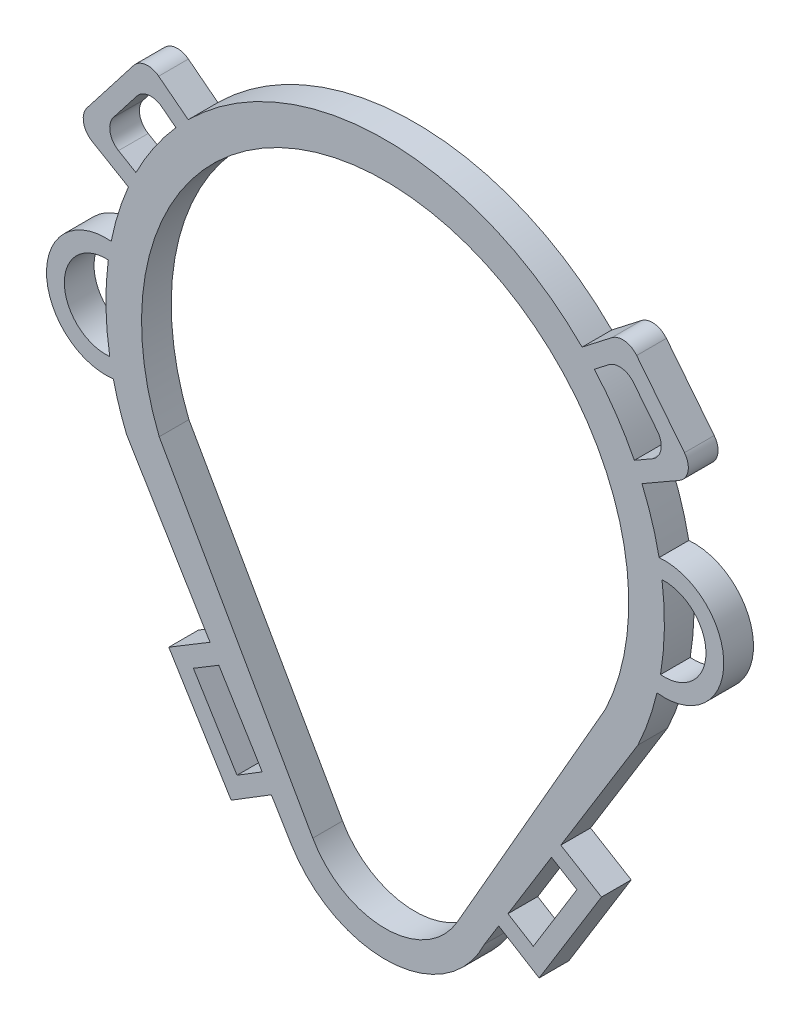
from build123d import *

# Parameters (mm, degrees)
BOSS_EXTRUDE1_DEPTH = 5
BOSS_EXTRUDE2_DEPTH = 5
BOSS_EXTRUDE3_DEPTH = 5
BOSS_EXTRUDE4_DEPTH = 5


with BuildPart() as part:
    # Sketch1 → Boss-Extrude1 (new body)
    with BuildSketch(Plane.XY):
        with BuildLine():
            Line((-43.525507403, -17.734999444), (-15.834143063, -63.566896663))
            ThreePointArc((-15.834143063, -63.566896663), (0.921831184, -72.476899782), (16.707746892, -61.94334892))
            Line((16.707746892, -61.94334892), (42.535849019, -19.992537313))
            ThreePointArc((42.535849019, -19.992537313), (1.232467134, 46.98383791), (-43.525507403, -17.734999444))
        make_face()
        with BuildLine():
            Line((-38.025051761, -15.332822263), (-12.177775824, -60.906647231))
            ThreePointArc((-12.177775824, -60.906647231), (-0.033510124, -67.999959895), (12.144573151, -60.964864893))
            Line((12.144573151, -60.964864893), (37.105740634, -17.440298507))
            ThreePointArc((37.105740634, -17.440298507), (1.149629187, 40.983879181), (-38.025051761, -15.332822263))
        make_face(mode=Mode.SUBTRACT)
    extrude(amount=BOSS_EXTRUDE1_DEPTH)

    # Sketch2 → Boss-Extrude2 (add)
    # profile 1 of 2: a face of its own
    with BuildSketch(Plane.XY.offset(5)):
        Polygon((25.915179254, -62.247528006), (36.414328126, -45.193958627), (26.996991102, -39.509073876), (16.548120684, -56.480456141), align=None)
        Polygon((27.992517968, -43.614270651), (20.675595382, -55.498645253), (24.93333337, -58.120031762), (32.273052279, -46.198264849), align=None, mode=Mode.SUBTRACT)
    # profile 2 of 2: a face of its own
    with BuildSketch(Plane.XY.offset(5)):
        Polygon((-16.548120684, -56.480456141), (-25.915179254, -62.247528006), (-36.414328126, -45.193958627), (-26.996991102, -39.509073876), align=None)
        Polygon((-32.273052279, -46.198264849), (-27.992517968, -43.614270651), (-20.675595382, -55.498645253), (-24.93333337, -58.120031762), align=None, mode=Mode.SUBTRACT)
    extrude(amount=-BOSS_EXTRUDE2_DEPTH)

    # Sketch3 → Boss-Extrude3 (add)
    # profile 1 of 2: a face of its own
    with BuildSketch(Plane.XY.offset(5)):
        with BuildLine():
            Line((-31.151373165, 31.772817784), (-38.114457897, 37.177116489))
            ThreePointArc((-38.114457897, 37.177116489), (-40.329006137, 37.783626199), (-42.323795344, 36.64657125))
            Line((-42.323795344, 36.64657125), (-50.184128352, 26.519047267))
            ThreePointArc((-50.184128352, 26.519047267), (-50.760622602, 24.115277799), (-49.336666072, 22.094683561))
            Line((-49.336666072, 22.094683561), (-41.03528616, 17.205385487))
            Line((-41.03528616, 17.205385487), (-31.151373165, 31.772817784))
        make_face()
        with BuildLine():
            Line((-35.213971315, 31.128382936), (-37.583912658, 32.967779041))
            ThreePointArc((-37.583912658, 32.967779041), (-39.798460899, 33.574288752), (-41.793250106, 32.437233803))
            Line((-41.793250106, 32.437233803), (-45.72341661, 27.373471811))
            ThreePointArc((-45.72341661, 27.373471811), (-46.29991086, 24.969702343), (-44.87595433, 22.949108105))
            Line((-44.87595433, 22.949108105), (-41.937721652, 21.218565047))
            Line((-41.937721652, 21.218565047), (-35.213971315, 31.128382936))
        make_face(mode=Mode.SUBTRACT)
    # profile 2 of 2: a face of its own
    with BuildSketch(Plane.XY.offset(5)):
        with BuildLine():
            Line((31.151373165, 31.772817784), (41.03528616, 17.205385487))
            Line((41.03528616, 17.205385487), (49.521231884, 22.082259987))
            ThreePointArc((49.521231884, 22.082259987), (50.972840228, 24.118942465), (50.376596508, 26.547879626))
            Line((50.376596508, 26.547879626), (42.329184832, 36.691250185))
            ThreePointArc((42.329184832, 36.691250185), (40.338269585, 37.80509541), (38.139596853, 37.19662773))
            Line((38.139596853, 37.19662773), (31.151373165, 31.772817784))
        make_face()
        with BuildLine():
            Line((35.213971315, 31.128382936), (41.937721652, 21.218565047))
            Line((41.937721652, 21.218565047), (44.9588763, 22.954823155))
            ThreePointArc((44.9588763, 22.954823155), (46.410484644, 24.991505634), (45.814240924, 27.420442794))
            Line((45.814240924, 27.420442794), (41.798639593, 32.481912737))
            ThreePointArc((41.798639593, 32.481912737), (39.807724347, 33.595757962), (37.609051614, 32.987290283))
            Line((37.609051614, 32.987290283), (35.213971315, 31.128382936))
        make_face(mode=Mode.SUBTRACT)
    extrude(amount=-BOSS_EXTRUDE3_DEPTH)

    # Sketch4 → Boss-Extrude4 (add)
    # profile 1 of 2: a face of its own
    with BuildSketch(Plane.XY.offset(5)):
        with BuildLine():
            Line((42.848392472, 8.262286082), (42.848392472, -9.939496711))
            ThreePointArc((42.848392472, -9.939496711), (56.992517927, -0.838605315), (42.848392472, 8.262286082))
        make_face()
        with BuildLine():
            Line((45.848392472, 6.067260087), (45.848392472, -7.744470716))
            ThreePointArc((45.848392472, -7.744470716), (53.992517927, -0.838605315), (45.848392472, 6.067260087))
        make_face(mode=Mode.SUBTRACT)
    # profile 2 of 2: a face of its own
    with BuildSketch(Plane.XY.offset(5)):
        with BuildLine():
            Line((-42.848392472, 8.262286082), (-42.848392472, -9.939496711))
            ThreePointArc((-42.848392472, -9.939496711), (-56.992517927, -0.838605315), (-42.848392472, 8.262286082))
        make_face()
        with BuildLine():
            Line((-45.848392472, 6.067260087), (-45.848392472, -7.744470716))
            ThreePointArc((-45.848392472, -7.744470716), (-53.992517927, -0.838605315), (-45.848392472, 6.067260087))
        make_face(mode=Mode.SUBTRACT)
    extrude(amount=-BOSS_EXTRUDE4_DEPTH)


solid = part.part
